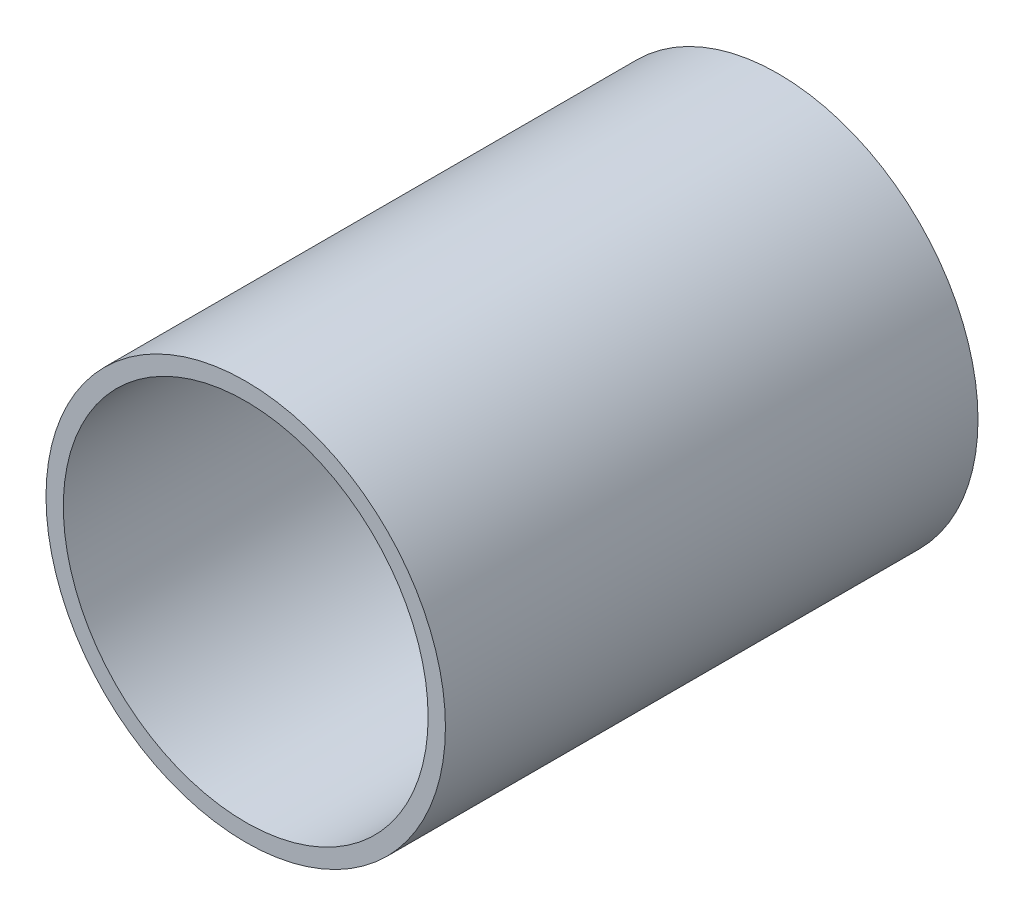
from build123d import *

# Parameters (mm, degrees)
SKETCH1_R           = 19.05
SKETCH1_R_2         = 17.399
BOSS_EXTRUDE1_DEPTH = 50.8


with BuildPart() as part:
    # Sketch1 → Boss-Extrude1 (new body)
    with BuildSketch(Plane.XY):
        Circle(SKETCH1_R)
        Circle(SKETCH1_R_2, mode=Mode.SUBTRACT)
    extrude(amount=BOSS_EXTRUDE1_DEPTH)


solid = part.part
